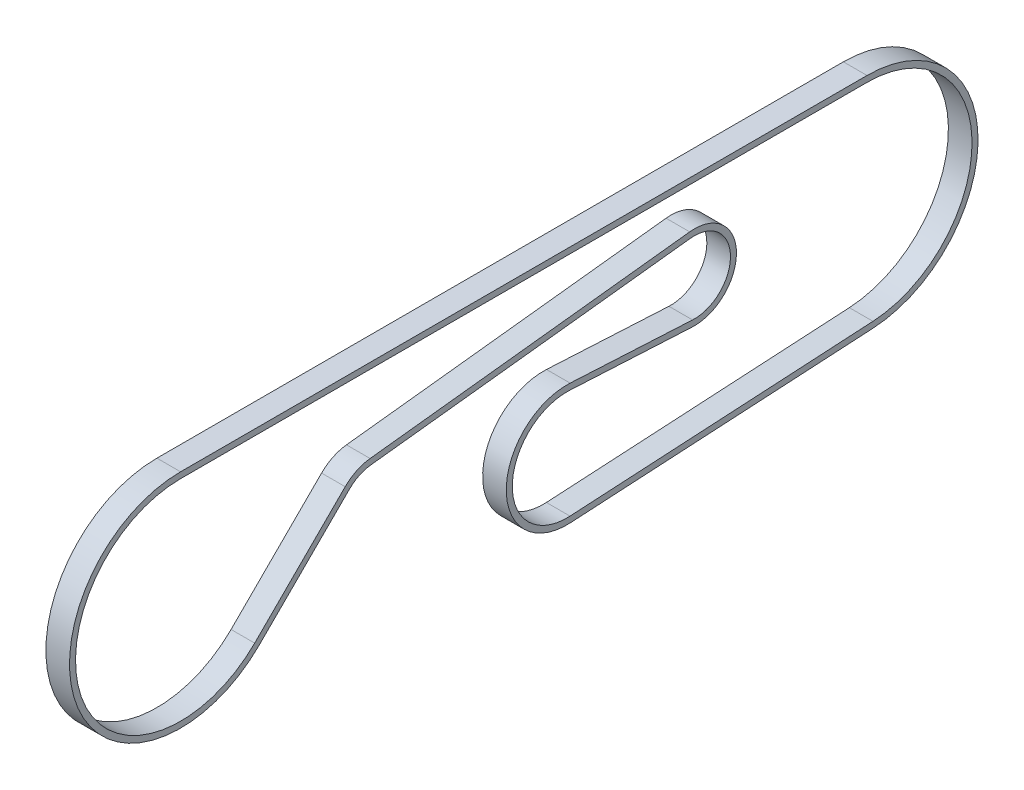
from build123d import *

# Parameters (mm, degrees)
BOSS_EXTRUDE1_DEPTH = 4


with BuildPart() as part:
    # Sketch1 → Boss-Extrude1 (new body)
    with BuildSketch(Plane.YZ):
        with BuildLine():
            Line((-45.297204985, 68.766275416), (-45.297204985, -47.438724583))
            ThreePointArc((-45.297204985, -47.438724583), (-63.559894946, -66.227157099), (-82.858941142, -48.504915228))
            Line((-82.858941142, -48.504915228), (-85.772675501, 2.778943341))
            ThreePointArc((-85.772675501, 2.778943341), (-75.542561207, 13.627257141), (-65.271611457, 2.817597479))
            Line((-65.271611457, 2.817597479), (-66.370650366, -17.905886036))
            ThreePointArc((-66.370650366, -17.905886036), (-60.09842319, -24.321923389), (-54.226508839, -17.537603901))
            Line((-54.226508839, -17.537603901), (-60.400008434, 36.564396099))
            ThreePointArc((-60.400008434, 36.564396099), (-60.963940599, 38.517279926), (-62.138586455, 40.176189762))
            Line((-62.138586455, 40.176189762), (-77.407402535, 55.498956184))
            ThreePointArc((-77.407402535, 55.498956184), (-71.270807609, 86.137850951), (-45.297204985, 68.766275416))
        make_face()
        with BuildLine():
            Line((-81.844577025, -48.447283301), (-84.758311385, 2.836575268))
            ThreePointArc((-84.758311385, 2.836575268), (-75.540645573, 12.611258947), (-66.286185688, 2.871403904))
            Line((-66.286185688, 2.871403904), (-67.385224597, -17.852079611))
            ThreePointArc((-67.385224597, -17.852079611), (-60.067626225, -25.337456524), (-53.217059482, -17.42241712))
            Line((-53.217059482, -17.42241712), (-59.390559076, 36.67958288))
            ThreePointArc((-59.390559076, 36.67958288), (-60.048479935, 38.957947345), (-61.418900101, 40.893342152))
            Line((-61.418900101, 40.893342152), (-76.687716181, 56.216108575))
            ThreePointArc((-76.687716181, 56.216108575), (-70.882829088, 85.198846868), (-46.313204985, 68.766275416))
            Line((-46.313204985, 68.766275416), (-46.313204985, -47.438724583))
            ThreePointArc((-46.313204985, -47.438724583), (-63.588722515, -65.211566152), (-81.844577025, -48.447283301))
        make_face(mode=Mode.SUBTRACT)
    extrude(amount=BOSS_EXTRUDE1_DEPTH)


solid = part.part
